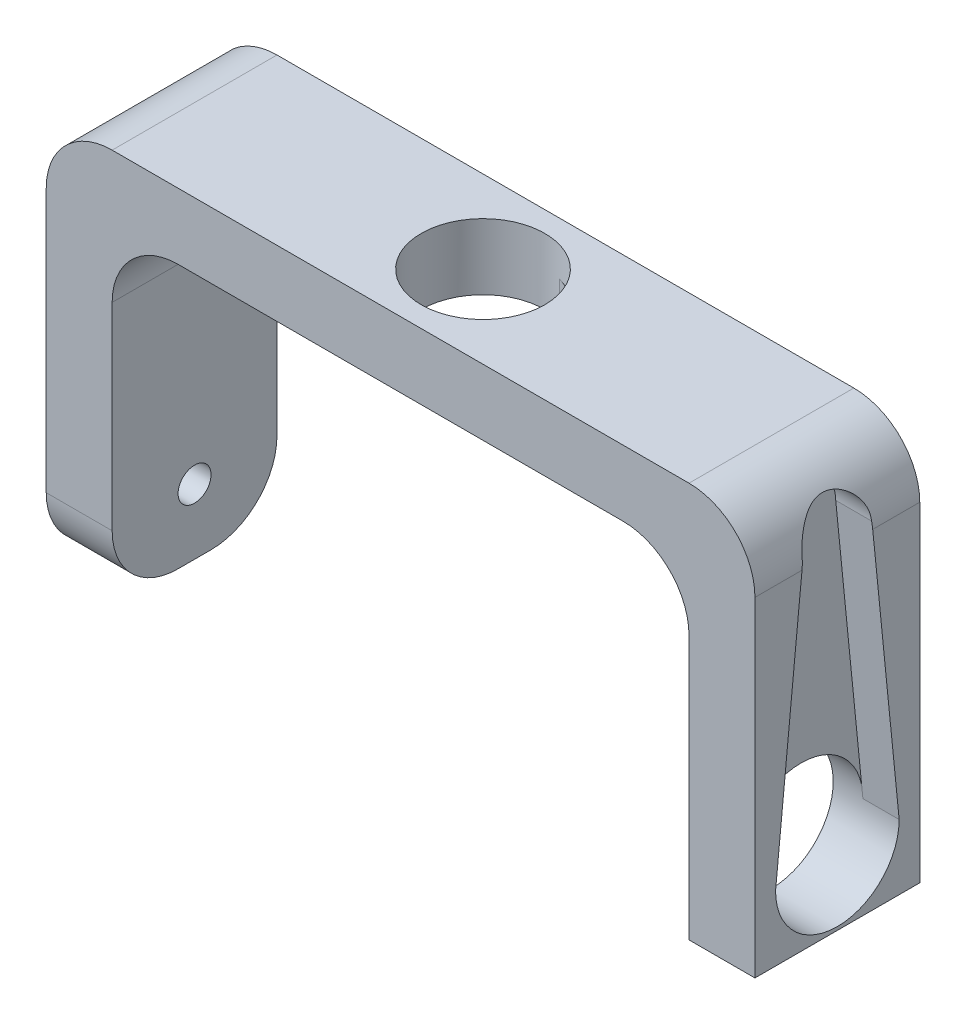
from build123d import *
from build123d.topology import SkipClean

# Parameters (mm, degrees)
EXTRUDE_THIN1_DEPTH = 10
FILLET1_R           = 4
CUT_EXTRUDE1_START  = -1.8
CUT_EXTRUDE1_DEPTH  = 44.155533586
CUT_EXTRUDE7_START  = -10
SKETCH10_R          = 3.75
CUT_EXTRUDE7_DEPTH  = 10
SKETCH4_R           = 1
CUT_EXTRUDE2_DEPTH  = 6
FILLET2_R           = 4
CUT_EXTRUDE5_START  = -1.8
CUT_EXTRUDE5_DEPTH  = 32.937960909
CUT_EXTRUDE9_START  = -10
SKETCH12_R          = 3.75
CUT_EXTRUDE9_DEPTH  = 10


with BuildPart() as part:
    # Sketch1 → Extrude-Thin1 (new body)
    with BuildSketch(Plane.XY):
        Polygon((-17.5, -20), (-17.5, 0), (17.5, 0), (17.5, -20), (21.5, -20), (21.5, 4), (-21.5, 4), (-21.5, -20), align=None)
    extrude(amount=EXTRUDE_THIN1_DEPTH)

    # Fillet1
    fillet1_edges = [part.edges().sort_by_distance(p)[0] for p in [
        (-21.5, 4, 5),
        (21.5, 4, 5),
        (17.5, 0, 5),
        (-17.5, 0, 5),
    ]]
    fillet(fillet1_edges, radius=FILLET1_R)

    # Sketch3 → Cut-Extrude1 (cut, through all)
    with BuildSketch(Plane.ZY.offset(-17.5).offset(CUT_EXTRUDE1_START)):
        with BuildLine():
            Line((1.324257426, -15.307425743), (1.25, -16.05))
            ThreePointArc((1.25, -16.05), (5, -19.8), (8.75, -16.05))
            Line((8.75, -16.05), (8.675742574, -15.307425743))
            Line((8.675742574, -15.307425743), (7.545, -4))
            Line((7.545, -4), (2.455, -4))
            Line((2.455, -4), (1.324257426, -15.307425743))
        make_face()
        with BuildLine():
            Line((2.9, 0.45), (2.455, -4))
            Line((2.455, -4), (7.545, -4))
            Line((7.545, -4), (7.1, 0.45))
            ThreePointArc((7.1, 0.45), (5, 2.55), (2.9, 0.45))
        make_face()
    extrude(amount=-CUT_EXTRUDE1_DEPTH, mode=Mode.SUBTRACT)

    # Sketch10 → Cut-Extrude7 (cut)
    with BuildSketch(Plane(origin=(19.3, 0, 0), x_dir=(0, 0, -1), z_dir=(1, 0, 0)).offset(CUT_EXTRUDE7_START)):
        with Locations(Location((-5, -16.05, 0), (0, 0, 270))):
            Circle(SKETCH10_R)
    extrude(amount=CUT_EXTRUDE7_DEPTH, mode=Mode.SUBTRACT)

    # Sketch4 → Cut-Extrude2 (cut)
    with BuildSketch(Plane.ZY.offset(21.5)):
        with Locations(Location((5, -16.05, 0), (0, 0, 270))):
            Circle(SKETCH4_R)
    extrude(amount=-CUT_EXTRUDE2_DEPTH, mode=Mode.SUBTRACT)

    # Fillet2
    fillet2_edges = [part.edges().sort_by_distance(p)[0] for p in [
        (-19.5, -20, 10),
        (-19.5, -20, 0),
    ]]
    fillet(fillet2_edges, radius=FILLET2_R)

    # Sketch8 → Cut-Extrude5 (cut, through all)
    with BuildSketch(Plane(origin=(0, 4, 0), x_dir=(1, 0, 0), z_dir=(0, 1, 0)).offset(CUT_EXTRUDE5_START)):
        with BuildLine():
            Line((1.034235097, -8.604560689), (16, -6.5))
            ThreePointArc((16, -6.5), (17.5, -5), (16, -3.5))
            Line((16, -3.5), (1.034235097, -1.395439311))
            ThreePointArc((1.034235097, -1.395439311), (-3.75, -5), (1.034235097, -8.604560689))
        make_face()
    extrude(amount=-CUT_EXTRUDE5_DEPTH, mode=Mode.SUBTRACT)

    # Sketch12 → Cut-Extrude9 (cut)
    with SkipClean():  # the faces are left unmerged after this step: merging them gives an invalid solid
        with BuildSketch(Plane.XZ.offset(-2.2).offset(CUT_EXTRUDE9_START)):
            with Locations(Location((0, 5, 0), (0, 0, 73.990542285))):
                Circle(SKETCH12_R)
        extrude(amount=CUT_EXTRUDE9_DEPTH, mode=Mode.SUBTRACT)


solid = part.part
